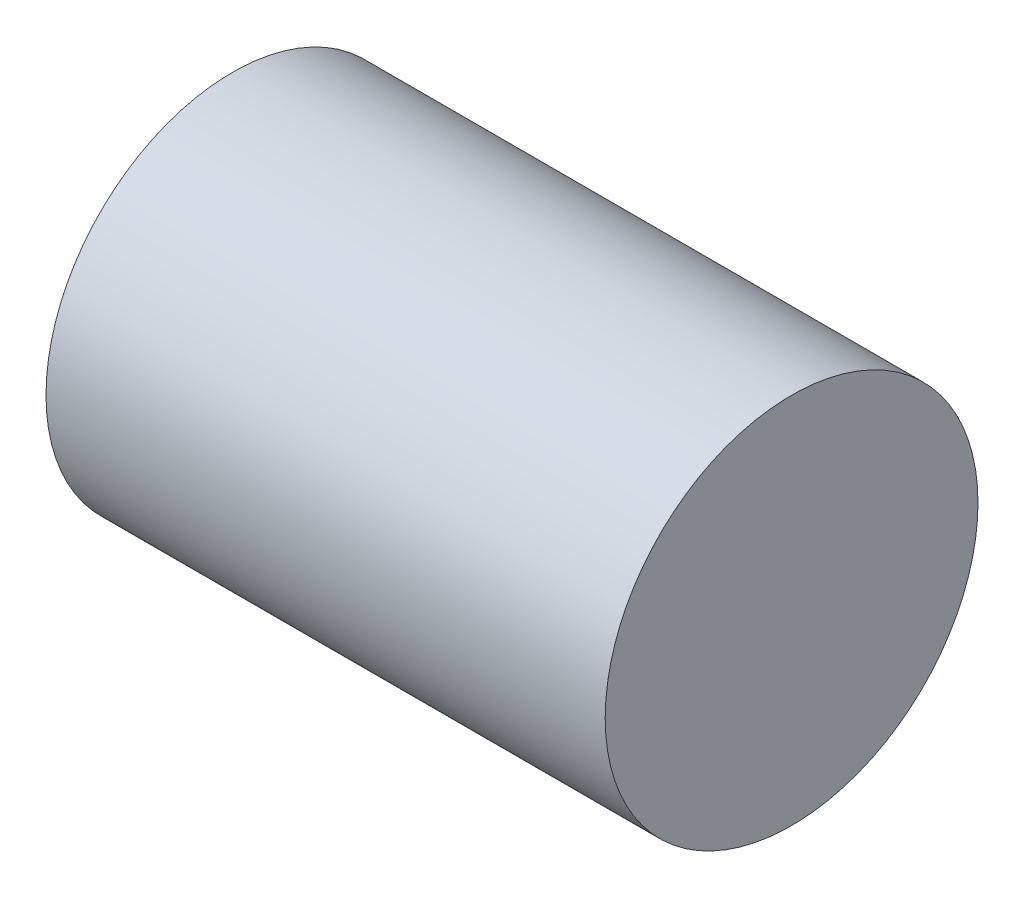
from build123d import *


with BuildPart() as part:
    # Sketch1 → Revolve1 (revolve)
    with BuildSketch(Plane.XY, mode=Mode.PRIVATE) as revolve1_sk:
        Polygon((0, 25.4), (-25.4, 25.4), (-76.2, 25.4), (-76.2, 0), (0, 0), align=None)
    revolve(revolve1_sk.sketch.rotate(Axis((64.330517711, 0, 0), (-1, 0, 0)), 90), axis=Axis((64.330517711, 0, 0), (-1, 0, 0)))


solid = part.part
